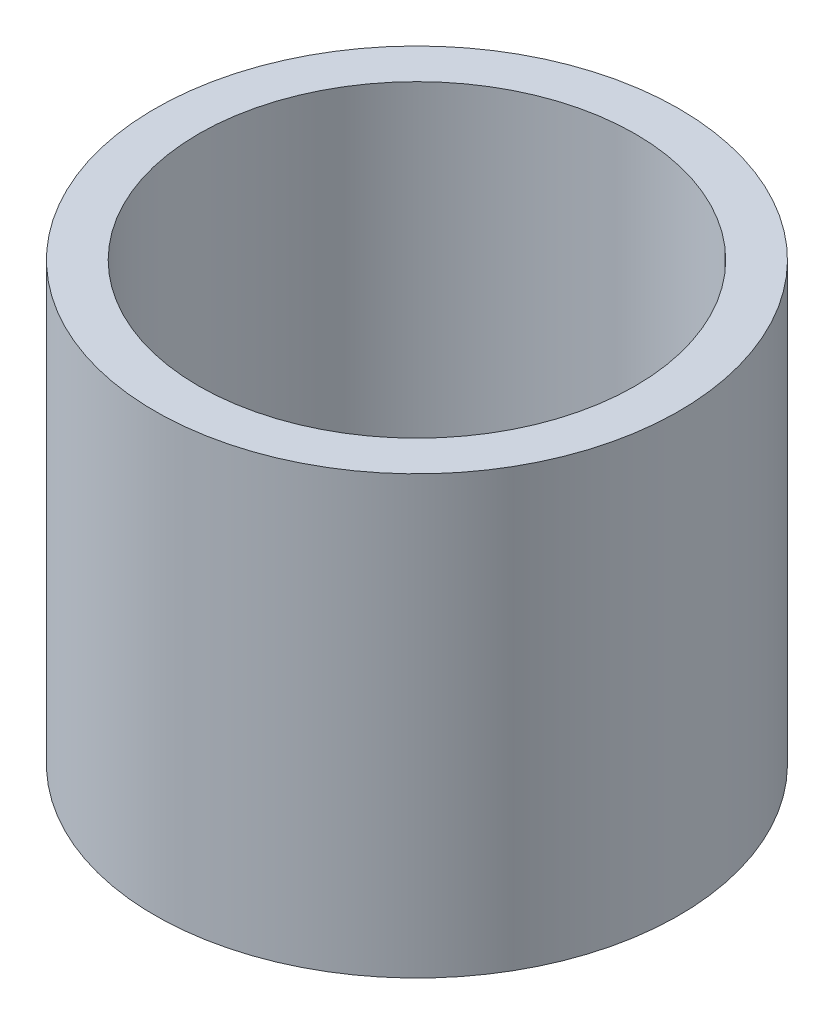
from build123d import *

# Parameters (mm, degrees)
SKETCH1_R           = 11.43
SKETCH1_R_2         = 9.525
BOSS_EXTRUDE1_DEPTH = 19.05


with BuildPart() as part:
    # Sketch1 → Boss-Extrude1 (new body)
    with BuildSketch(Plane(origin=(0, 0, 0), x_dir=(1, 0, 0), z_dir=(0, 1, 0))):
        with Locations(Location((0, 0, 0), (0, 0, 90))):
            Circle(SKETCH1_R)
        with Locations(Location((0, 0, 0), (0, 0, 90))):
            Circle(SKETCH1_R_2, mode=Mode.SUBTRACT)
    extrude(amount=BOSS_EXTRUDE1_DEPTH)


solid = part.part
